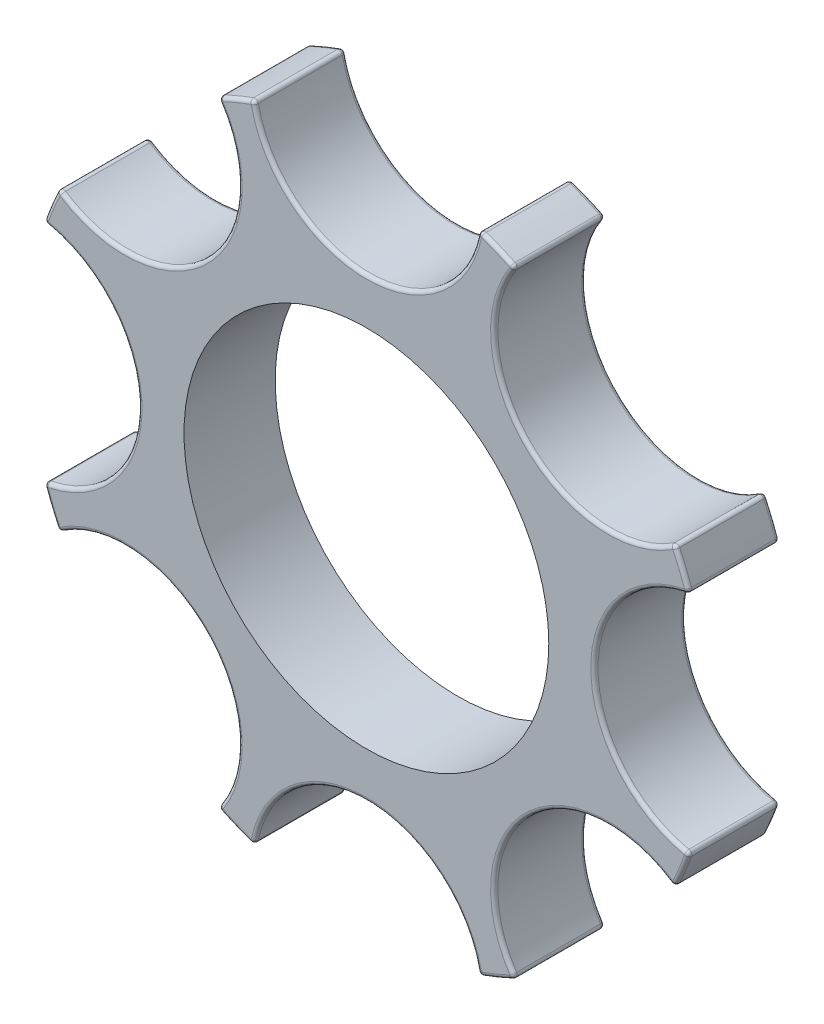
from build123d import *

# Parameters (mm, degrees)
SKETCH1_R           = 10.16
BOSS_EXTRUDE1_DEPTH = 5.08
FILLET1_R           = 0.2032


with BuildPart() as part:
    # Sketch1 → Boss-Extrude1 (new body)
    with BuildSketch(Plane.XY):
        with BuildLine():
            ThreePointArc((-17.991666667, -6.261184437), (-12.7, 0), (-17.991666667, 6.261184437))
            ThreePointArc((-17.991666667, 6.261184437), (-17.599905094, 7.290119387), (-17.149355479, 8.294703531))
            ThreePointArc((-17.149355479, 8.294703531), (-8.980256121, 8.980256121), (-8.294703531, 17.149355479))
            ThreePointArc((-8.294703531, 17.149355479), (-7.290119387, 17.599905094), (-6.261184437, 17.991666667))
            ThreePointArc((-6.261184437, 17.991666667), (0, 12.7), (6.261184437, 17.991666667))
            ThreePointArc((6.261184437, 17.991666667), (7.290119387, 17.599905094), (8.294703531, 17.149355479))
            ThreePointArc((8.294703531, 17.149355479), (8.980256121, 8.980256121), (17.149355479, 8.294703531))
            ThreePointArc((17.149355479, 8.294703531), (17.599905094, 7.290119387), (17.991666667, 6.261184437))
            ThreePointArc((17.991666667, 6.261184437), (12.7, 0), (17.991666667, -6.261184437))
            ThreePointArc((17.991666667, -6.261184437), (17.599905094, -7.290119387), (17.149355479, -8.294703531))
            ThreePointArc((17.149355479, -8.294703531), (8.980256121, -8.980256121), (8.294703531, -17.149355479))
            ThreePointArc((8.294703531, -17.149355479), (7.290119387, -17.599905094), (6.261184437, -17.991666667))
            ThreePointArc((6.261184437, -17.991666667), (0, -12.7), (-6.261184437, -17.991666667))
            ThreePointArc((-6.261184437, -17.991666667), (-7.290119387, -17.599905094), (-8.294703531, -17.149355479))
            ThreePointArc((-8.294703531, -17.149355479), (-8.980256121, -8.980256121), (-17.149355479, -8.294703531))
            ThreePointArc((-17.149355479, -8.294703531), (-17.599905094, -7.290119387), (-17.991666667, -6.261184437))
        make_face()
        Circle(SKETCH1_R, mode=Mode.SUBTRACT)
    extrude(amount=BOSS_EXTRUDE1_DEPTH)

    # Fillet1
    fillet1_edges = [part.edges().sort_by_distance(p)[0] for p in [
        (7.290119387, 17.599905094, 5.08),
        (0, 12.7, 5.08),
        (-7.290119387, 17.599905094, 5.08),
        (-12.7, 0, 5.08),
        (-8.980256121, 8.980256121, 5.08),
        (-17.599905094, 7.290119387, 5.08),
        (-17.599905094, -7.290119387, 5.08),
        (-17.599905094, 7.290119387, 0),
        (-8.980256121, 8.980256121, 0),
        (-7.290119387, 17.599905094, 0),
        (0, 12.7, 0),
        (7.290119387, 17.599905094, 0),
        (-8.980256121, -8.980256121, 5.08),
        (8.980256121, 8.980256121, 0),
        (17.599905094, 7.290119387, 0),
        (12.7, 0, 0),
        (17.599905094, -7.290119387, 0),
        (8.980256121, -8.980256121, 0),
        (7.290119387, -17.599905094, 0),
        (-7.290119387, -17.599905094, 5.08),
        (0, -12.7, 0),
        (-7.290119387, -17.599905094, 0),
        (-8.980256121, -8.980256121, 0),
        (-17.599905094, -7.290119387, 0),
        (-12.7, 0, 0),
        (-17.991666667, 6.261184437, 2.54),
        (-17.149355479, 8.294703531, 2.54),
        (-8.294703531, 17.149355479, 2.54),
        (-6.261184437, 17.991666667, 2.54),
        (6.261184437, 17.991666667, 2.54),
        (8.294703531, 17.149355479, 2.54),
        (17.149355479, 8.294703531, 2.54),
        (17.991666667, 6.261184437, 2.54),
        (17.991666667, -6.261184437, 2.54),
        (17.149355479, -8.294703531, 2.54),
        (8.294703531, -17.149355479, 2.54),
        (6.261184437, -17.991666667, 2.54),
        (-6.261184437, -17.991666667, 2.54),
        (-8.294703531, -17.149355479, 2.54),
        (-17.149355479, -8.294703531, 2.54),
        (-17.991666667, -6.261184437, 2.54),
        (0, -12.7, 5.08),
        (7.290119387, -17.599905094, 5.08),
        (8.980256121, -8.980256121, 5.08),
        (17.599905094, -7.290119387, 5.08),
        (12.7, 0, 5.08),
        (17.599905094, 7.290119387, 5.08),
        (8.980256121, 8.980256121, 5.08),
    ]]
    fillet(fillet1_edges, radius=FILLET1_R)


solid = part.part
